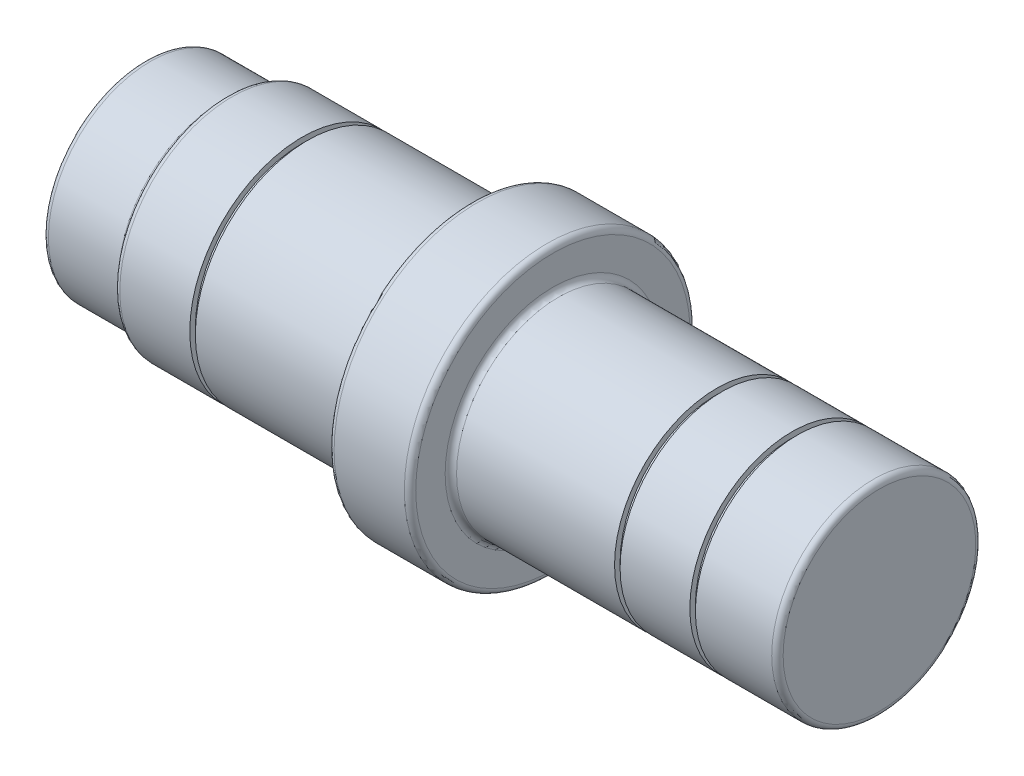
from build123d import *

# Parameters (mm, degrees)
CUT_EXTRUDE1_START = -28.575
CUT_EXTRUDE1_DEPTH = 209.510564723
CUT_EXTRUDE2_REACH = 264.486
CUT_EXTRUDE2_START = -25.4


with BuildPart() as part:
    # Sketch1 → Revolve1 (revolve)
    with BuildSketch(Plane(origin=(0, 0, 0), x_dir=(1, 0, 0), z_dir=(0, 1, 0))):
        with BuildLine():
            Line((0, 29.972), (0, 0))
            Line((0, 0), (133.35, 0))
            ThreePointArc((133.35, 0), (135.209871939, 4.490128061), (139.7, 6.35))
            Line((139.7, 6.35), (165.1, 6.35))
            ThreePointArc((165.1, 6.35), (169.590128061, 4.490128061), (171.45, 0))
            Line((171.45, 0), (228.6, 0))
            Line((228.6, 0), (228.6, 29.972))
            ThreePointArc((228.6, 29.972), (228.079235857, 31.229235857), (226.822, 31.75))
            Line((226.822, 31.75), (203.073, 31.75))
            Line((203.073, 31.75), (203.073, 30.0228))
            Line((203.073, 30.0228), (201.3458, 30.0228))
            Line((201.3458, 30.0228), (201.3458, 31.75))
            Line((201.3458, 31.75), (179.6542, 31.75))
            Line((179.6542, 31.75), (179.6542, 30.0228))
            Line((179.6542, 30.0228), (177.927, 30.0228))
            Line((177.927, 30.0228), (177.927, 31.75))
            Line((177.927, 31.75), (128.778, 31.75))
            ThreePointArc((128.778, 31.75), (127.520764143, 32.270764143), (127, 33.528))
            Line((127, 33.528), (127, 42.672))
            ThreePointArc((127, 42.672), (126.479235857, 43.929235857), (125.222, 44.45))
            Line((125.222, 44.45), (103.378, 44.45))
            ThreePointArc((103.378, 44.45), (102.120764143, 43.929235857), (101.6, 42.672))
            Line((101.6, 42.672), (101.6, 36.703))
            ThreePointArc((101.6, 36.703), (101.079235857, 35.445764143), (99.822, 34.925))
            Line((99.822, 34.925), (50.673, 34.925))
            Line((50.673, 34.925), (50.673, 33.1978))
            Line((50.673, 33.1978), (48.9458, 33.1978))
            Line((48.9458, 33.1978), (48.9458, 34.925))
            Line((48.9458, 34.925), (27.178, 34.925))
            ThreePointArc((27.178, 34.925), (25.920764143, 34.404235857), (25.4, 33.147))
            Line((25.4, 33.147), (25.4, 33.528))
            ThreePointArc((25.4, 33.528), (24.879235857, 32.270764143), (23.622, 31.75))
            Line((23.622, 31.75), (1.778, 31.75))
            ThreePointArc((1.778, 31.75), (0.520764143, 31.229235857), (0, 29.972))
        make_face()
    revolve(axis=Axis((0, 0, 0), (1, 0, 0)))

    # Sketch1<7> → Cut-Extrude1 (cut, through all)
    with BuildSketch(Plane(origin=(0, 0, 0), x_dir=(1, 0, 0), z_dir=(0, 1, 0)).offset(CUT_EXTRUDE1_START)):
        with BuildLine():
            ThreePointArc((63.5, 6.35), (57.15, 0), (63.5, -6.35))
            Line((63.5, -6.35), (88.9, -6.35))
            ThreePointArc((88.9, -6.35), (95.25, 0), (88.9, 6.35))
            Line((88.9, 6.35), (63.5, 6.35))
        make_face()
    extrude(amount=-CUT_EXTRUDE1_DEPTH, mode=Mode.SUBTRACT)

    # Sketch1<10> → Cut-Extrude2 (cut, up to next)
    with BuildSketch(Plane(origin=(0, 0, 0), x_dir=(1, 0, 0), z_dir=(0, 1, 0)).offset(CUT_EXTRUDE2_START), mode=Mode.PRIVATE) as cut_extrude2_sk1:
        with BuildLine():
            Line((139.7, 6.35), (165.1, 6.35))
            ThreePointArc((165.1, 6.35), (171.45, 0), (165.1, -6.35))
            Line((165.1, -6.35), (139.7, -6.35))
            ThreePointArc((139.7, -6.35), (133.35, 0), (139.7, 6.35))
        make_face()
    cut_extrude2_tool1 = extrude(cut_extrude2_sk1.sketch, amount=-CUT_EXTRUDE2_REACH, mode=Mode.PRIVATE) & part.part
    add(cut_extrude2_tool1.solids().sort_by_distance((152.4, -25.4, 0))[0], mode=Mode.SUBTRACT)


solid = part.part
